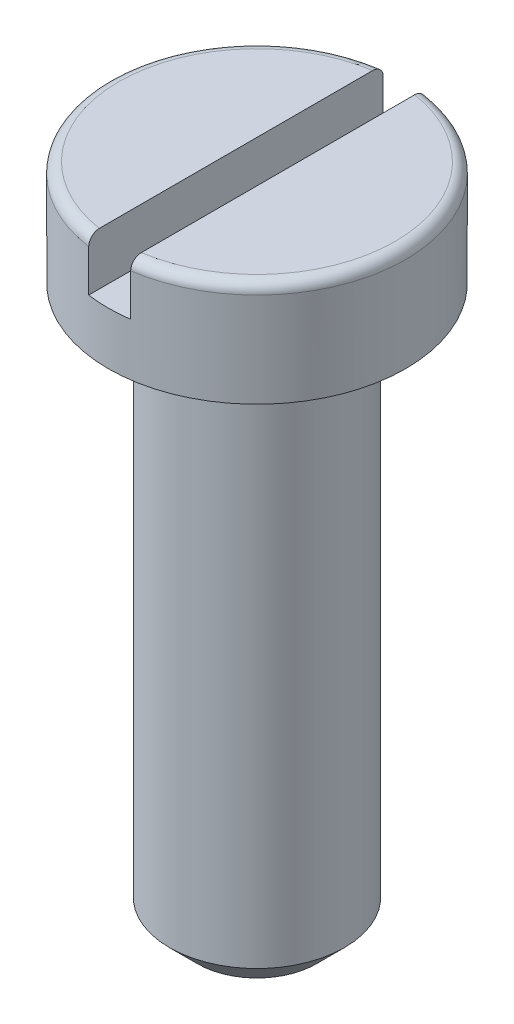
from build123d import *

# Parameters (mm, degrees)
TIGE_START              = -16
ESQUISSE1_R             = 2.5
TIGE_DEPTH              = 16
CHANFREIN_D_ENTR_E_SIZE = 0.8
ESQUISSE3_W             = 1.2
ESQUISSE3_H             = 8.5
FENTE_DEPTH             = 1.5


with BuildPart() as part:
    # Esquisse1 → Tige (new body)
    with BuildSketch(Plane(origin=(0, 0, 0), x_dir=(1, 0, 0), z_dir=(0, 1, 0)).offset(TIGE_START)):
        with Locations(Location((0, 0, 0), (0, 0, 270))):
            Circle(ESQUISSE1_R)
    extrude(amount=TIGE_DEPTH)

    # Chanfrein d'entrée
    chanfrein_d_entr_e_edges = [part.edges().sort_by_distance(p)[0] for p in [
        (0, -16, -2.5),
    ]]
    chamfer(chanfrein_d_entr_e_edges, length=CHANFREIN_D_ENTR_E_SIZE)

    # Esquisse2 → Tête (revolve)
    with BuildSketch(Plane.XY, mode=Mode.PRIVATE) as t_te_sk:
        with BuildLine():
            Line((0, 0), (4.25, 0))
            Line((4.25, 0), (4.25, 2.7))
            ThreePointArc((4.25, 2.7), (4.162132034, 2.912132034), (3.95, 3))
            Line((3.95, 3), (0, 3))
            Line((0, 3), (0, 0))
        make_face()
    revolve(t_te_sk.sketch.rotate(Axis((0, 3, 0), (0, -1, 0)), 180), axis=Axis((0, 3, 0), (0, -1, 0)))

    # Esquisse3 → Fente (cut)
    with BuildSketch(Plane(origin=(0, 3, -1.8), x_dir=(1, 0, 0), z_dir=(0, -1, 0))):
        with Locations((0, 1.8)):
            Rectangle(ESQUISSE3_W, ESQUISSE3_H)
    extrude(amount=FENTE_DEPTH, mode=Mode.SUBTRACT)


solid = part.part
